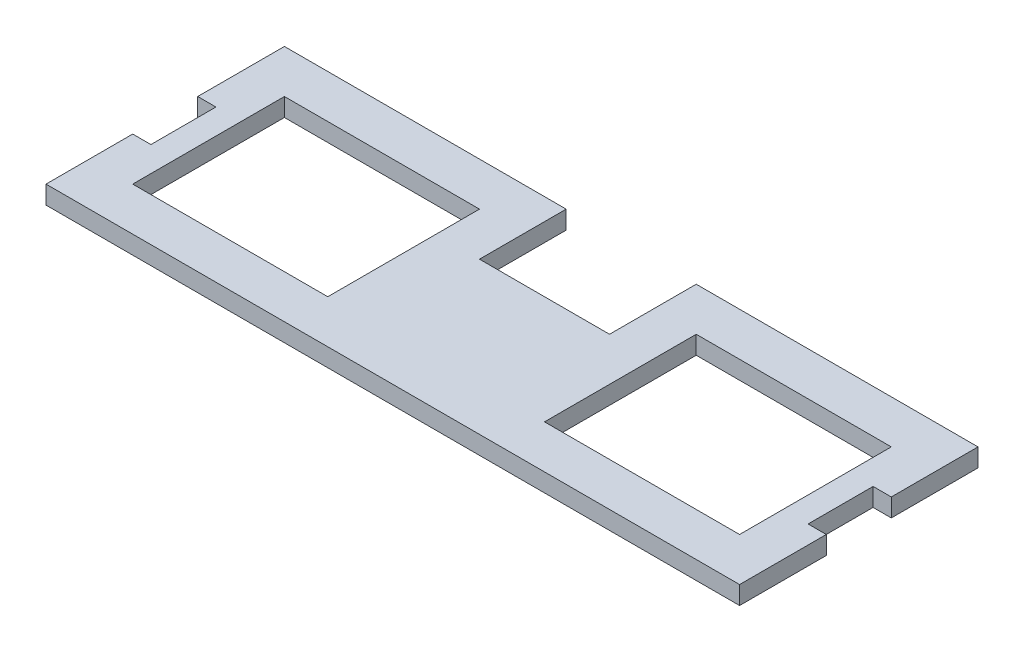
from build123d import *

# Parameters (mm, degrees)
SKETCH1_W              = 203.2
SKETCH1_H              = 69.85
BASE_DEPTH             = 5.334
SKETCH2_W              = 5.334
SKETCH2_H              = 19.05
SLOTS_DEPTH            = 215.936534949
SKETCH3_W              = 38.1
SKETCH3_H              = 25.4
CENTER_CUTOUT_DEPTH    = 215.936534949
WEIGHT_REDUCTION_DEPTH = 215.936534949


with BuildPart() as part:
    # Sketch1 → Base (new body)
    with BuildSketch(Plane(origin=(0, 0, 0), x_dir=(1, 0, 0), z_dir=(0, 1, 0))):
        with Locations((101.6, 34.925)):
            Rectangle(SKETCH1_W, SKETCH1_H)
    extrude(amount=BASE_DEPTH)

    # Sketch2 → Slots (cut, through all)
    with BuildSketch(Plane(origin=(0, 5.334, 0), x_dir=(1, 0, 0), z_dir=(0, 1, 0))):
        with Locations((2.667, 34.925)):
            Rectangle(SKETCH2_W, SKETCH2_H)
        with Locations((200.533, 34.925)):
            Rectangle(SKETCH2_W, SKETCH2_H)
    extrude(amount=-SLOTS_DEPTH, mode=Mode.SUBTRACT)

    # Sketch3 → Center Cutout (cut, through all)
    with BuildSketch(Plane(origin=(0, 5.334, 0), x_dir=(1, 0, 0), z_dir=(0, 1, 0))):
        with Locations((101.6, 57.15)):
            Rectangle(SKETCH3_W, SKETCH3_H)
    extrude(amount=-CENTER_CUTOUT_DEPTH, mode=Mode.SUBTRACT)

    # Sketch4 → Weight Reduction (cut, through all)
    with BuildSketch(Plane(origin=(0, 5.334, 0), x_dir=(1, 0, 0), z_dir=(0, 1, 0))):
        Polygon((69.85, 44.45), (69.85, 57.15), (12.7, 57.15), (12.7, 44.45), (12.7, 25.4), (12.7, 12.7), (69.85, 12.7), align=None)
        Polygon((190.5, 25.4), (190.5, 12.7), (133.35, 12.7), (133.35, 44.45), (133.35, 57.15), (190.5, 57.15), (190.5, 44.45), align=None)
    extrude(amount=-WEIGHT_REDUCTION_DEPTH, mode=Mode.SUBTRACT)


solid = part.part
